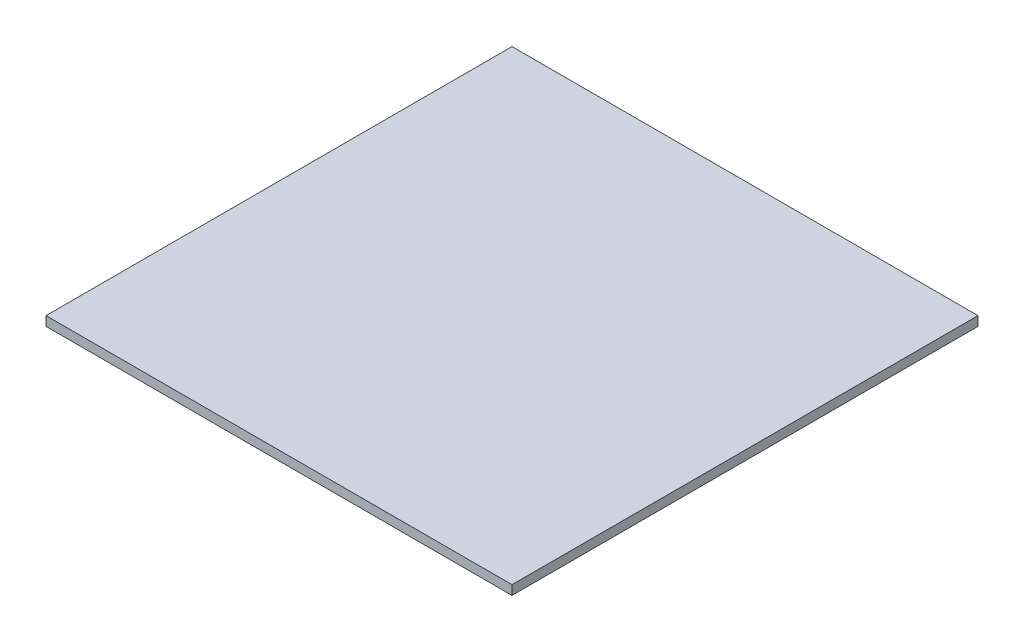
from build123d import *

# Parameters (mm, degrees)
ESBO_O1_W                = 100
ESBO_O1_H                = 100
RESSALTO_EXTRUS_O1_DEPTH = 2


with BuildPart() as part:
    # Esboço1 → Ressalto-extrusão1 (new body)
    with BuildSketch(Plane(origin=(0, 0, 0), x_dir=(1, 0, 0), z_dir=(0, 1, 0))):
        Rectangle(ESBO_O1_W, ESBO_O1_H)
    extrude(amount=RESSALTO_EXTRUS_O1_DEPTH)


solid = part.part
